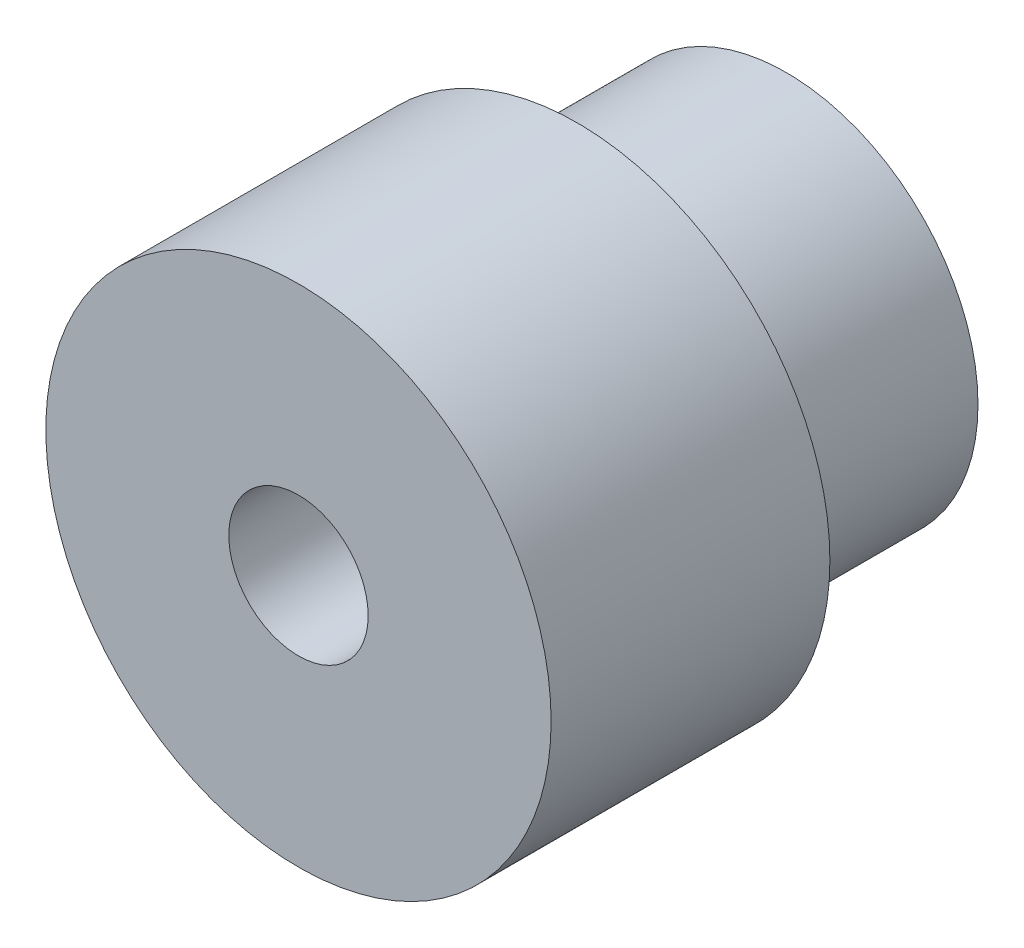
from build123d import *

# Parameters (mm, degrees)
SKETCH1_R               = 14.5
BOSS_EXTRUDE1_DEPTH     = 16
SKETCH2_R               = 11
BOSS_EXTRUDE2_DEPTH     = 12
CUT_EXTRUDE1_DEPTH      = 27.009613607
CUT_EXTRUDE1_DEPTH_BACK = 27.009613607
SKETCH3_R               = 4


with BuildPart() as part:
    # Sketch1 → Boss-Extrude1 (new body)
    with BuildSketch(Plane.XY):
        Circle(SKETCH1_R)
    extrude(amount=BOSS_EXTRUDE1_DEPTH)

    # Sketch2 → Boss-Extrude2 (add)
    with BuildSketch(Plane.XY):
        Circle(SKETCH2_R)
    extrude(amount=-BOSS_EXTRUDE2_DEPTH)

    # Sketch3 → Cut-Extrude1 (cut, two sides: drawn at the far end of the back side and taken through both)
    with BuildSketch(Plane.XY.offset(-CUT_EXTRUDE1_DEPTH_BACK)):
        Circle(SKETCH3_R)
    extrude(amount=CUT_EXTRUDE1_DEPTH + CUT_EXTRUDE1_DEPTH_BACK, mode=Mode.SUBTRACT)


solid = part.part
